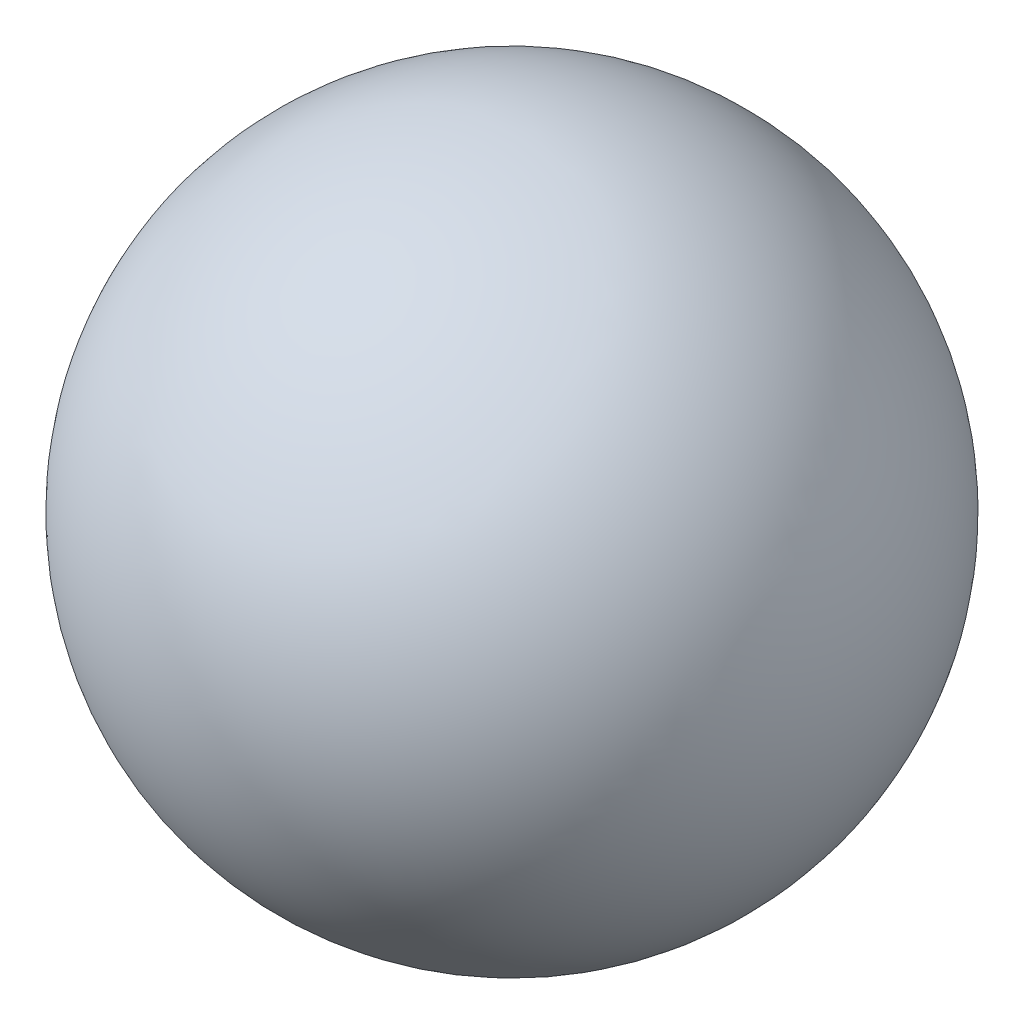
from build123d import *


with BuildPart() as part:
    # Sketch1 → Revolve1 (revolve)
    with BuildSketch(Plane.XY):
        with BuildLine():
            Line((-120, 0), (120, 0))
            ThreePointArc((120, 0), (0, -120), (-120, 0))
        make_face()
    revolve(axis=Axis((-120, 0, 0), (1, 0, 0)))


solid = part.part
